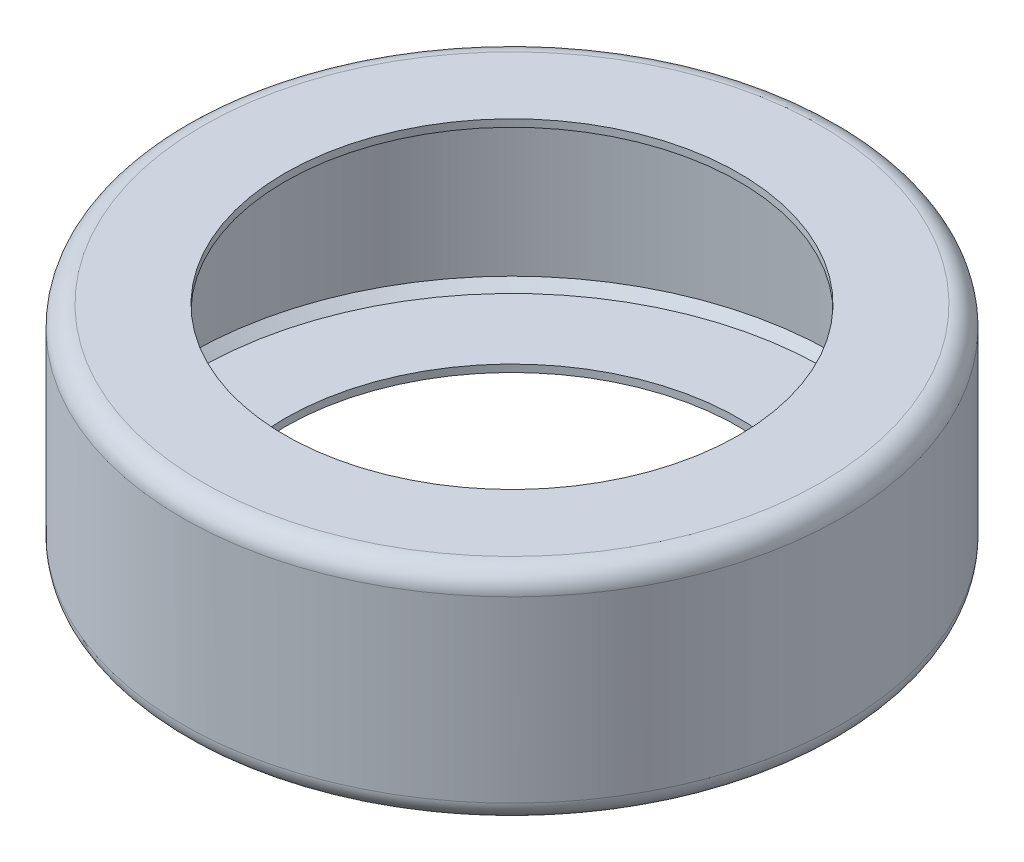
from build123d import *

# Parameters (mm, degrees)
FILLET2_R     = 0.7
CHAMFER1_SIZE = 0.3


with BuildPart() as part:
    # Sketch1 → Revolve1 (revolve)
    with BuildSketch(Plane.XY, mode=Mode.PRIVATE) as revolve1_sk:
        Polygon((-11.25, 3.75), (-11.25, -3.75), (-7.75, -3.75), (-7.75, -3.5), (-11, -3.5), (-11, 3.5), (-7.75, 3.5), (-7.75, 3.75), align=None)
    revolve(revolve1_sk.sketch.rotate(Axis((0, -3.75, 0), (0, 1, 0)), 180), axis=Axis((0, -3.75, 0), (0, 1, 0)))

    # Fillet2
    fillet2_edges = [part.edges().sort_by_distance(p)[0] for p in [
        (-11.25, 3.75, 0),
        (-11.25, -3.75, 0),
    ]]
    fillet(fillet2_edges, radius=FILLET2_R)

    # Chamfer1
    chamfer1_edges = [part.edges().sort_by_distance(p)[0] for p in [
        (-11, -3.5, 0),
        (-11, 3.5, 0),
    ]]
    chamfer(chamfer1_edges, length=CHAMFER1_SIZE)


solid = part.part
